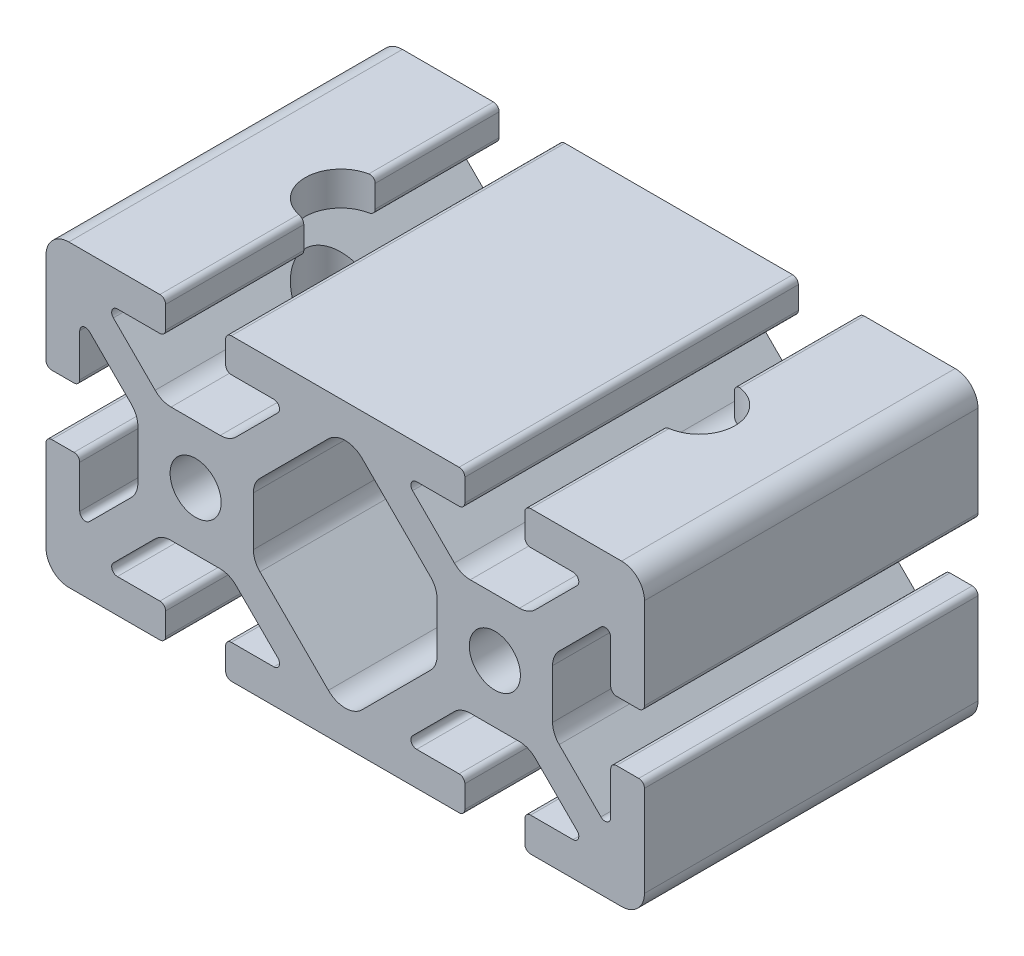
from build123d import *

# Parameters (mm, degrees)
SKETCH1_R          = 3.4036
EXTRUDE1_DEPTH     = 22.225
CUT_EXTRUDE1_REACH = 77.248
SKETCH2_R          = 4.7625


with BuildPart() as part:
    # Sketch1 → Extrude1 (new, symmetric)
    with BuildSketch(Plane.XY):
        with BuildLine():
            Line((-19.939, 16.891), (-19.939, 4.7625))
            ThreePointArc((-19.939, 4.7625), (-19.715815367, 4.223684633), (-19.177, 4.0005))
            Line((-19.177, 4.0005), (-16.2052, 4.0005))
            ThreePointArc((-16.2052, 4.0005), (-15.666384633, 4.223684633), (-15.4432, 4.7625))
            Line((-15.4432, 4.7625), (-15.4432, 10.424558599))
            ThreePointArc((-15.4432, 10.424558599), (-14.972804775, 11.128554802), (-14.142384633, 10.963373966))
            Line((-14.142384633, 10.963373966), (-8.574059555, 5.395048889))
            ThreePointArc((-8.574059555, 5.395048889), (-7.924348265, 4.422687227), (-7.6962, 3.275708444))
            Line((-7.6962, 3.275708444), (-7.6962, -3.275708444))
            ThreePointArc((-7.6962, -3.275708444), (-7.924348265, -4.422687227), (-8.574059555, -5.395048889))
            Line((-8.574059555, -5.395048889), (-14.142384633, -10.963373966))
            ThreePointArc((-14.142384633, -10.963373966), (-14.972804775, -11.128554802), (-15.4432, -10.424558599))
            Line((-15.4432, -10.424558599), (-15.4432, -4.7625))
            ThreePointArc((-15.4432, -4.7625), (-15.666384633, -4.223684633), (-16.2052, -4.0005))
            Line((-16.2052, -4.0005), (-19.177, -4.0005))
            ThreePointArc((-19.177, -4.0005), (-19.715815367, -4.223684633), (-19.939, -4.7625))
            Line((-19.939, -4.7625), (-19.939, -16.891))
            ThreePointArc((-19.939, -16.891), (-19.046261469, -19.046261469), (-16.891, -19.939))
            Line((-16.891, -19.939), (-4.7625, -19.939))
            ThreePointArc((-4.7625, -19.939), (-4.223684633, -19.715815367), (-4.0005, -19.177))
            Line((-4.0005, -19.177), (-4.0005, -16.2052))
            ThreePointArc((-4.0005, -16.2052), (-4.223684633, -15.666384633), (-4.7625, -15.4432))
            Line((-4.7625, -15.4432), (-10.424558599, -15.4432))
            ThreePointArc((-10.424558599, -15.4432), (-11.128554802, -14.972804775), (-10.963373966, -14.142384633))
            Line((-10.963373966, -14.142384633), (-5.395048889, -8.574059555))
            ThreePointArc((-5.395048889, -8.574059555), (-4.422687227, -7.924348265), (-3.275708444, -7.6962))
            Line((-3.275708444, -7.6962), (3.275708444, -7.6962))
            ThreePointArc((3.275708444, -7.6962), (4.422687227, -7.924348265), (5.395048889, -8.574059555))
            Line((5.395048889, -8.574059555), (10.963373966, -14.142384633))
            ThreePointArc((10.963373966, -14.142384633), (11.128554802, -14.972804775), (10.424558599, -15.4432))
            Line((10.424558599, -15.4432), (4.7625, -15.4432))
            ThreePointArc((4.7625, -15.4432), (4.223684633, -15.666384633), (4.0005, -16.2052))
            Line((4.0005, -16.2052), (4.0005, -19.177))
            ThreePointArc((4.0005, -19.177), (4.223684633, -19.715815367), (4.7625, -19.939))
            Line((4.7625, -19.939), (19.939, -19.939))
            Line((19.939, -19.939), (35.1155, -19.939))
            ThreePointArc((35.1155, -19.939), (35.654315367, -19.715815367), (35.8775, -19.177))
            Line((35.8775, -19.177), (35.8775, -16.2052))
            ThreePointArc((35.8775, -16.2052), (35.654315367, -15.666384633), (35.1155, -15.4432))
            Line((35.1155, -15.4432), (29.453441401, -15.4432))
            ThreePointArc((29.453441401, -15.4432), (28.749445198, -14.972804775), (28.914626034, -14.142384633))
            Line((28.914626034, -14.142384633), (34.482951111, -8.574059555))
            ThreePointArc((34.482951111, -8.574059555), (35.455312773, -7.924348265), (36.602291556, -7.6962))
            Line((36.602291556, -7.6962), (43.153708444, -7.6962))
            ThreePointArc((43.153708444, -7.6962), (44.300687227, -7.924348265), (45.273048889, -8.574059555))
            Line((45.273048889, -8.574059555), (50.841373966, -14.142384633))
            ThreePointArc((50.841373966, -14.142384633), (51.006554802, -14.972804775), (50.302558599, -15.4432))
            Line((50.302558599, -15.4432), (44.6405, -15.4432))
            ThreePointArc((44.6405, -15.4432), (44.101684633, -15.666384633), (43.8785, -16.2052))
            Line((43.8785, -16.2052), (43.8785, -19.177))
            ThreePointArc((43.8785, -19.177), (44.101684633, -19.715815367), (44.6405, -19.939))
            Line((44.6405, -19.939), (56.769, -19.939))
            ThreePointArc((56.769, -19.939), (58.924261469, -19.046261469), (59.817, -16.891))
            Line((59.817, -16.891), (59.817, -4.7625))
            ThreePointArc((59.817, -4.7625), (59.593815367, -4.223684633), (59.055, -4.0005))
            Line((59.055, -4.0005), (56.0832, -4.0005))
            ThreePointArc((56.0832, -4.0005), (55.544384633, -4.223684633), (55.3212, -4.7625))
            Line((55.3212, -4.7625), (55.3212, -10.424558599))
            ThreePointArc((55.3212, -10.424558599), (54.850804775, -11.128554802), (54.020384633, -10.963373966))
            Line((54.020384633, -10.963373966), (48.452059555, -5.395048889))
            ThreePointArc((48.452059555, -5.395048889), (47.802348265, -4.422687227), (47.5742, -3.275708444))
            Line((47.5742, -3.275708444), (47.5742, 3.275708444))
            ThreePointArc((47.5742, 3.275708444), (47.802348265, 4.422687227), (48.452059555, 5.395048889))
            Line((48.452059555, 5.395048889), (54.020384633, 10.963373966))
            ThreePointArc((54.020384633, 10.963373966), (54.850804775, 11.128554802), (55.3212, 10.424558599))
            Line((55.3212, 10.424558599), (55.3212, 4.7625))
            ThreePointArc((55.3212, 4.7625), (55.544384633, 4.223684633), (56.0832, 4.0005))
            Line((56.0832, 4.0005), (59.055, 4.0005))
            ThreePointArc((59.055, 4.0005), (59.593815367, 4.223684633), (59.817, 4.7625))
            Line((59.817, 4.7625), (59.817, 16.891))
            ThreePointArc((59.817, 16.891), (58.924261469, 19.046261469), (56.769, 19.939))
            Line((56.769, 19.939), (44.6405, 19.939))
            ThreePointArc((44.6405, 19.939), (44.101684633, 19.715815367), (43.8785, 19.177))
            Line((43.8785, 19.177), (43.8785, 16.2052))
            ThreePointArc((43.8785, 16.2052), (44.101684633, 15.666384633), (44.6405, 15.4432))
            Line((44.6405, 15.4432), (50.302558599, 15.4432))
            ThreePointArc((50.302558599, 15.4432), (51.006554802, 14.972804775), (50.841373966, 14.142384633))
            Line((50.841373966, 14.142384633), (45.273048889, 8.574059555))
            ThreePointArc((45.273048889, 8.574059555), (44.300687227, 7.924348265), (43.153708444, 7.6962))
            Line((43.153708444, 7.6962), (36.602291556, 7.6962))
            ThreePointArc((36.602291556, 7.6962), (35.455312773, 7.924348265), (34.482951111, 8.574059555))
            Line((34.482951111, 8.574059555), (28.914626034, 14.142384633))
            ThreePointArc((28.914626034, 14.142384633), (28.749445198, 14.972804775), (29.453441401, 15.4432))
            Line((29.453441401, 15.4432), (35.1155, 15.4432))
            ThreePointArc((35.1155, 15.4432), (35.654315367, 15.666384633), (35.8775, 16.2052))
            Line((35.8775, 16.2052), (35.8775, 19.177))
            ThreePointArc((35.8775, 19.177), (35.654315367, 19.715815367), (35.1155, 19.939))
            Line((35.1155, 19.939), (4.7625, 19.939))
            ThreePointArc((4.7625, 19.939), (4.223684633, 19.715815367), (4.0005, 19.177))
            Line((4.0005, 19.177), (4.0005, 16.2052))
            ThreePointArc((4.0005, 16.2052), (4.223684633, 15.666384633), (4.7625, 15.4432))
            Line((4.7625, 15.4432), (10.424558599, 15.4432))
            ThreePointArc((10.424558599, 15.4432), (11.128554802, 14.972804775), (10.963373966, 14.142384633))
            Line((10.963373966, 14.142384633), (5.395048889, 8.574059555))
            ThreePointArc((5.395048889, 8.574059555), (4.422687227, 7.924348265), (3.275708444, 7.6962))
            Line((3.275708444, 7.6962), (-3.275708444, 7.6962))
            ThreePointArc((-3.275708444, 7.6962), (-4.422687227, 7.924348265), (-5.395048889, 8.574059555))
            Line((-5.395048889, 8.574059555), (-10.963373966, 14.142384633))
            ThreePointArc((-10.963373966, 14.142384633), (-11.128554802, 14.972804775), (-10.424558599, 15.4432))
            Line((-10.424558599, 15.4432), (-4.7625, 15.4432))
            ThreePointArc((-4.7625, 15.4432), (-4.223684633, 15.666384633), (-4.0005, 16.2052))
            Line((-4.0005, 16.2052), (-4.0005, 19.177))
            ThreePointArc((-4.0005, 19.177), (-4.223684633, 19.715815367), (-4.7625, 19.939))
            Line((-4.7625, 19.939), (-16.891, 19.939))
            ThreePointArc((-16.891, 19.939), (-19.046261469, 19.046261469), (-19.939, 16.891))
        make_face()
        Circle(SKETCH1_R, mode=Mode.SUBTRACT)
        with Locations(Location((39.878, 0, 0), (0, 0, 180))):
            Circle(SKETCH1_R, mode=Mode.SUBTRACT)
        with BuildLine():
            Line((7.6962, 3.275708444), (7.6962, -3.275708444))
            ThreePointArc((7.6962, -3.275708444), (7.924348265, -4.422687227), (8.574059555, -5.395048889))
            Line((8.574059555, -5.395048889), (17.6911, -14.512089333))
            ThreePointArc((17.6911, -14.512089333), (19.939, -15.4432), (22.1869, -14.512089333))
            Line((22.1869, -14.512089333), (31.303940445, -5.395048889))
            ThreePointArc((31.303940445, -5.395048889), (31.953651735, -4.422687227), (32.1818, -3.275708444))
            Line((32.1818, -3.275708444), (32.1818, 3.275708444))
            ThreePointArc((32.1818, 3.275708444), (31.953651735, 4.422687227), (31.303940445, 5.395048889))
            Line((31.303940445, 5.395048889), (22.1869, 14.512089333))
            ThreePointArc((22.1869, 14.512089333), (19.939, 15.4432), (17.6911, 14.512089333))
            Line((17.6911, 14.512089333), (8.574059555, 5.395048889))
            ThreePointArc((8.574059555, 5.395048889), (7.924348265, 4.422687227), (7.6962, 3.275708444))
        make_face(mode=Mode.SUBTRACT)
    extrude(amount=EXTRUDE1_DEPTH, both=True)

    # Cut-Extrude1: up to this face of the body (flat: up to its plane)
    cut_extrude1_end = Plane(part.part.faces().sort_by_distance((19.939, -19.939, 0))[0])
    # Sketch2 → Cut-Extrude1 (cut, up to the picked face)
    with BuildSketch(Plane(origin=(0, 19.939, 0), x_dir=(-1, 0, 0), z_dir=(0, 1, 0)), mode=Mode.PRIVATE) as cut_extrude1_sk1:
        with Locations(Location((-43.937, -0.95, 0), (0, 0, 80.533514111))):
            Circle(SKETCH2_R)
    cut_extrude1_tool1 = split(extrude(cut_extrude1_sk1.sketch, amount=-CUT_EXTRUDE1_REACH, mode=Mode.PRIVATE), bisect_by=cut_extrude1_end, keep=Keep.BOTH, mode=Mode.PRIVATE)
    # Sketch2 → Cut-Extrude1 (cut, up to the picked face)
    with BuildSketch(Plane(origin=(0, 19.939, 0), x_dir=(-1, 0, 0), z_dir=(0, 1, 0)), mode=Mode.PRIVATE) as cut_extrude1_sk2:
        with Locations(Location((3.815, -0.95, 0), (0, 0, 70.623830612))):
            Circle(SKETCH2_R)
    cut_extrude1_tool2 = split(extrude(cut_extrude1_sk2.sketch, amount=-CUT_EXTRUDE1_REACH, mode=Mode.PRIVATE), bisect_by=cut_extrude1_end, keep=Keep.BOTH, mode=Mode.PRIVATE)
    add(cut_extrude1_tool1.solids().sort_by(Axis((43.937, 19.939, -0.95), (0, -1, 0)))[0], mode=Mode.SUBTRACT)
    add(cut_extrude1_tool2.solids().sort_by(Axis((-3.815, 19.939, -0.95), (0, -1, 0)))[0], mode=Mode.SUBTRACT)


solid = part.part
